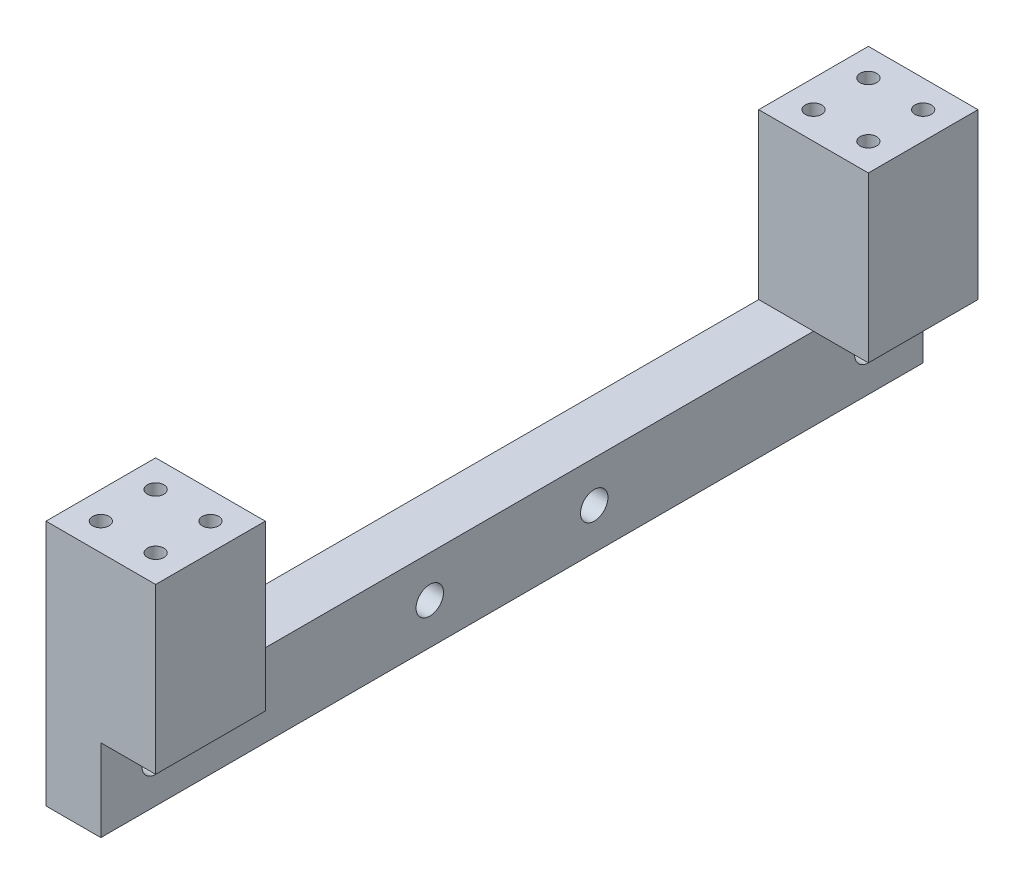
from build123d import *

# Parameters (mm, degrees)
SKETCH_1_W          = 10
SKETCH_1_H          = 150
EXTRUDE_1_DEPTH     = 15
SKETCH_2_W          = 20
SKETCH_2_H          = 20
EXTRUDE_2_DEPTH     = 30
SKETCH_3_R          = 2.5
CUT_EXTRUDE_1_DEPTH = 90.721792225
SKETCH_4_R          = 1.5
CUT_EXTRUDE_2_DEPTH = 10


with BuildPart() as part:
    # 草图1 → 凸台-拉伸1 (new body)
    with BuildSketch(Plane(origin=(0, 0, 0), x_dir=(1, 0, 0), z_dir=(0, 1, 0))):
        Rectangle(SKETCH_1_W, SKETCH_1_H)
    extrude(amount=EXTRUDE_1_DEPTH)

    # 草图2 → 凸台-拉伸2 (add)
    with BuildSketch(Plane(origin=(0, 15, 0), x_dir=(1, 0, 0), z_dir=(0, 1, 0))):
        with Locations((5, 65)):
            Rectangle(SKETCH_2_W, SKETCH_2_H)
        with Locations((5, -65)):
            Rectangle(SKETCH_2_W, SKETCH_2_H)
    extrude(amount=EXTRUDE_2_DEPTH)

    # 草图3 → 切除-拉伸1 (cut, through all)
    with BuildSketch(Plane.ZY.offset(5)):
        with Locations((-65, 7.5)):
            Circle(SKETCH_3_R)
        with Locations((-15, 7.5)):
            Circle(SKETCH_3_R)
        with Locations((15, 7.5)):
            Circle(SKETCH_3_R)
        with Locations((65, 7.5)):
            Circle(SKETCH_3_R)
    extrude(amount=-CUT_EXTRUDE_1_DEPTH, mode=Mode.SUBTRACT)

    # 草图4 → 切除-拉伸2 (cut)
    with BuildSketch(Plane(origin=(0, 45, 0), x_dir=(1, 0, 0), z_dir=(0, 1, 0))):
        with Locations(Location((0, 70, 0), (0, 0, 270))):
            Circle(SKETCH_4_R)
        with Locations(Location((10, 70, 0), (0, 0, 270))):
            Circle(SKETCH_4_R)
        with Locations(Location((0, 60, 0), (0, 0, 270))):
            Circle(SKETCH_4_R)
        with Locations(Location((10, 60, 0), (0, 0, 270))):
            Circle(SKETCH_4_R)
    cut_extrude_2 = extrude(amount=-CUT_EXTRUDE_2_DEPTH, mode=Mode.SUBTRACT)

    # 镜向1: 切除-拉伸2 across plane
    add(cut_extrude_2.mirror(Plane.XY), mode=Mode.SUBTRACT)


solid = part.part
